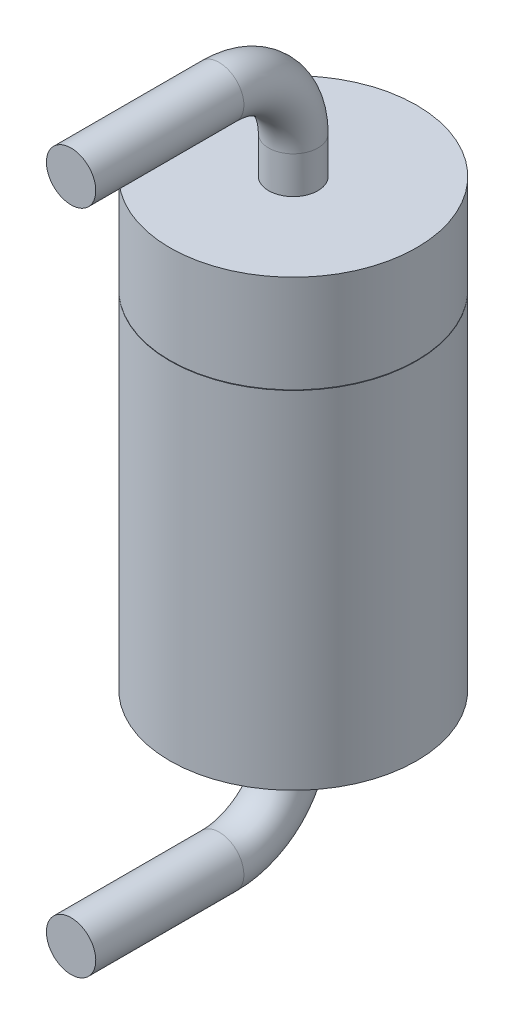
from build123d import *

# Parameters (mm, degrees)
SKETCH_1_R      = 2.5
EXTRUDE_1_DEPTH = 9
SKETCH_4_W      = 1.07639592
SKETCH_4_H      = 0.25
SKETCH_5_R      = 2.5
EXTRUDE_3_DEPTH = 0.24
SKETCH_6_R      = 0.5


with BuildPart() as part:
    # 草图1 → 凸台-拉伸1 (new body)
    with BuildSketch(Plane(origin=(0, 0, 0), x_dir=(1, 0, 0), z_dir=(0, 1, 0))):
        with Locations(Location((0, 0, 0), (0, 0, 270))):
            Circle(SKETCH_1_R)
    extrude(amount=EXTRUDE_1_DEPTH)

    # 草图4 → 切除-旋转1 (revolve, cut)
    with BuildSketch(Plane.XY, mode=Mode.PRIVATE) as cut_revolve_1_sk:
        with Locations((-2.83819796, 6.898899293)):
            Rectangle(SKETCH_4_W, SKETCH_4_H)
    revolve(cut_revolve_1_sk.sketch.rotate(Axis((0, 9.45, 0), (0, -1, 0)), 270), axis=Axis((0, 9.45, 0), (0, -1, 0)), mode=Mode.SUBTRACT)

    # 草图5 → 凸台-拉伸3 (add)
    with BuildSketch(Plane(origin=(0, 6.773899293, 0), x_dir=(1, 0, 0), z_dir=(0, 1, 0))):
        with Locations(Location((0, 0, 0), (0, 0, 270))):
            Circle(SKETCH_5_R)
    extrude(amount=EXTRUDE_3_DEPTH)

    # 扫描1: sweep along a path in 草图7
    with BuildLine(Plane(origin=(0, 0, 0), x_dir=(0, 0, -1), z_dir=(1, 0, 0))) as sweep_1_path:
        Line((-4.5, -2.75), (-1.5, -2.75))
        ThreePointArc((-1.5, -2.75), (-0.085786438, -2.164213562), (0.5, -0.75))
        Line((0.5, -0.75), (0.5, 0))
    # 草图6 → 扫描1 (sweep)
    with BuildSketch(Plane.XZ):
        Circle(SKETCH_6_R)
    sweep_1 = sweep(path=sweep_1_path.line)

    # 镜向1: 扫描1 across plane
    add(sweep_1.mirror(Plane.ZX.offset(4.5)))


solid = part.part
